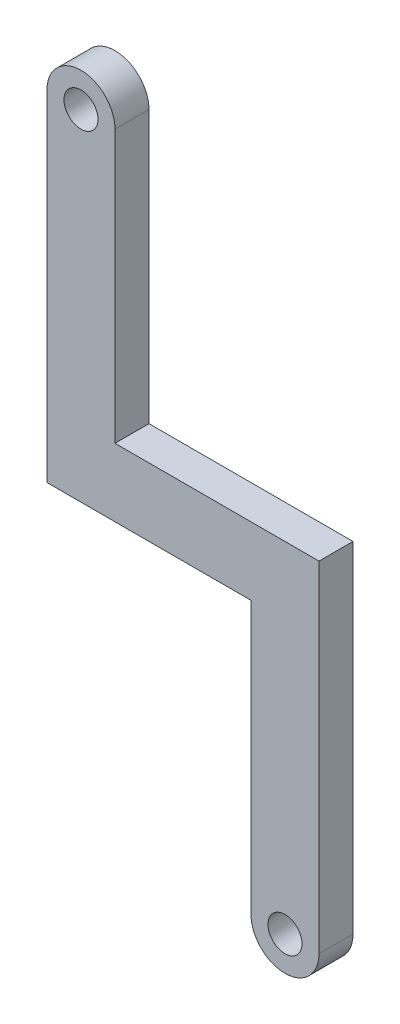
from build123d import *

# Parameters (mm, degrees)
SKETCH2_R           = 2.5
SKETCH2_R_2         = 1.25
BOSS_EXTRUDE2_DEPTH = 2.5


with BuildPart() as part:
    # Sketch2 → Boss-Extrude2 (new body)
    # profile 1 of 3: a face of its own
    with BuildSketch(Plane.XY):
        with BuildLine():
            Line((-12.5, 25), (-12.5, 45))
            ThreePointArc((-12.5, 45), (-15, 42.5), (-17.5, 45))
            Line((-17.5, 45), (-17.5, 20))
            Line((-17.5, 20), (-2.5, 20))
            Line((-2.5, 20), (-2.5, 0))
            ThreePointArc((-2.5, 0), (0, 2.5), (2.5, 0))
            Line((2.5, 0), (2.5, 25))
            Line((2.5, 25), (-12.5, 25))
        make_face()
    # profile 2 of 3: a face of its own
    with BuildSketch(Plane.XY):
        with Locations((-15, 45)):
            Circle(SKETCH2_R)
        with Locations((-15, 45)):
            Circle(SKETCH2_R_2, mode=Mode.SUBTRACT)
    # profile 3 of 3: a face of its own
    with BuildSketch(Plane.XY):
        Circle(SKETCH2_R)
        Circle(SKETCH2_R_2, mode=Mode.SUBTRACT)
    extrude(amount=BOSS_EXTRUDE2_DEPTH)


solid = part.part
